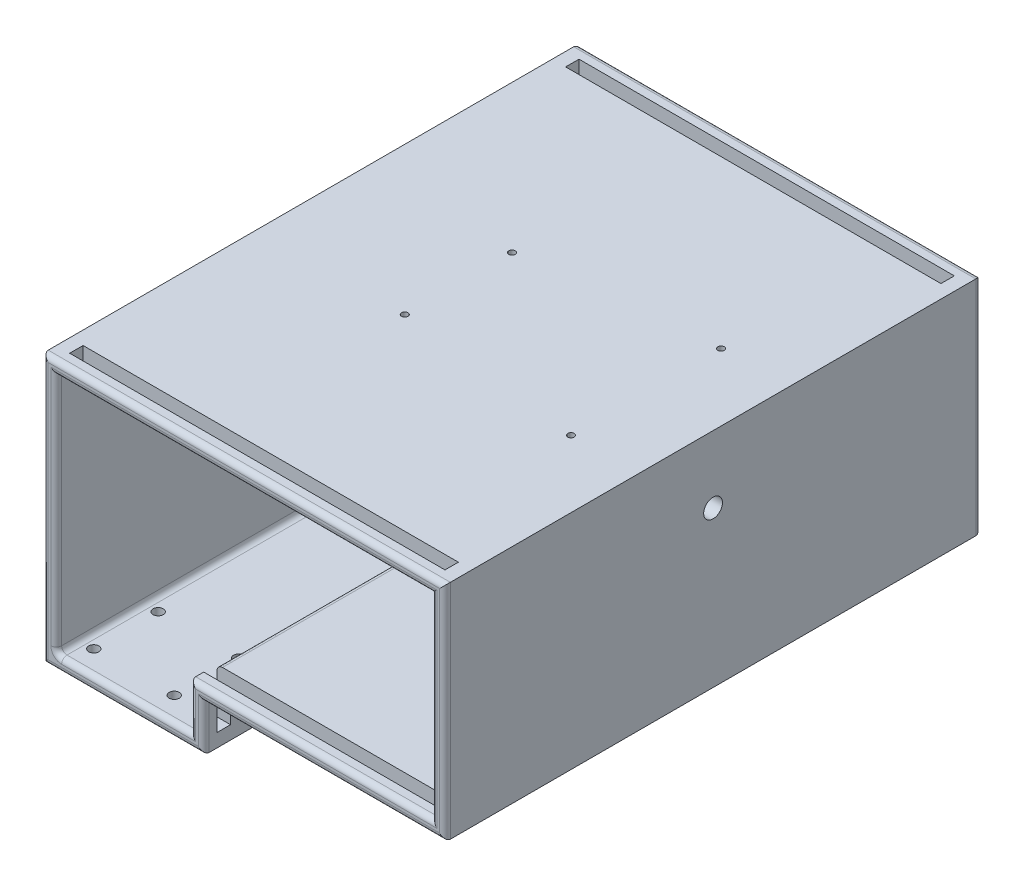
from build123d import *

# Parameters (mm, degrees)
SKETCH1_W           = 150
SKETCH1_H           = 200
BOSS_EXTRUDE1_DEPTH = 100
SHELL2_T            = -5
SKETCH5_R           = 1.9
CUT_EXTRUDE2_DEPTH  = 10
BOSS_EXTRUDE4_DEPTH = 200
SKETCH9_W           = 101.133931545
SKETCH9_H           = 31.996148617
CUT_EXTRUDE4_DEPTH  = 236.849528301
SKETCH10_R          = 4
CUT_EXTRUDE5_DEPTH  = 10
CUT_EXTRUDE7_REACH  = 162.078
SKETCH11_W          = 140
SKETCH11_H          = 5
SKETCH15_R          = 1.2
CUT_EXTRUDE11_DEPTH = 10
SKETCH36_W          = 60
SKETCH36_H          = 5
BOSS_EXTRUDE7_DEPTH = 10
FILLET1_R           = 2
SKETCH37_R          = 3.5
CUT_EXTRUDE15_DEPTH = 60
SKETCH38_R          = 5
CUT_EXTRUDE16_DEPTH = 70


with BuildPart() as part:
    # Sketch1 → Boss-Extrude1 (new body)
    with BuildSketch(Plane(origin=(0, 0, 0), x_dir=(1, 0, 0), z_dir=(0, 1, 0))):
        Rectangle(SKETCH1_W, SKETCH1_H)
    extrude(amount=BOSS_EXTRUDE1_DEPTH)

    # Shell2
    shell2_openings = [part.faces().sort_by_distance(p)[0] for p in [
        (0, 50, -100),
        (0, 50, 100),
    ]]
    offset(amount=SHELL2_T, openings=shell2_openings, kind=Kind.INTERSECTION)

    # Sketch5 → Cut-Extrude2 (cut)
    with BuildSketch(Plane.XZ):
        with Locations(Location((-65, 91, 0), (0, 0, 270))):
            Circle(SKETCH5_R)
        with Locations(Location((-35, 91, 0), (0, 0, 270))):
            Circle(SKETCH5_R)
        with Locations(Location((-65, 67, 0), (0, 0, 270))):
            Circle(SKETCH5_R)
        with Locations(Location((-35, 67, 0), (0, 0, 270))):
            Circle(SKETCH5_R)
    cut_extrude2 = extrude(amount=-CUT_EXTRUDE2_DEPTH, mode=Mode.SUBTRACT)

    # Mirror2: Cut-Extrude2 across plane
    add(cut_extrude2.mirror(Plane.XY), mode=Mode.SUBTRACT)

    # Sketch8 → Boss-Extrude4 (add, through all)
    with BuildSketch(Plane.XY.offset(100)):
        Polygon((-15, 17), (75, 17), (75, 22), (-20, 22), (-20, 0), (-15, 0), align=None)
    extrude(amount=-BOSS_EXTRUDE4_DEPTH)

    # Sketch9 → Cut-Extrude4 (cut, through all)
    with BuildSketch(Plane.XY.offset(100)):
        with Locations((35.566965773, 1.001925691)):
            Rectangle(SKETCH9_W, SKETCH9_H)
    extrude(amount=-CUT_EXTRUDE4_DEPTH, mode=Mode.SUBTRACT)

    # Sketch10 → Cut-Extrude5 (cut)
    with BuildSketch(Plane.XZ.offset(-17)):
        with Locations((60, 0)):
            Circle(SKETCH10_R)
    extrude(amount=-CUT_EXTRUDE5_DEPTH, mode=Mode.SUBTRACT)

    # Cut-Extrude7: up to this face of the body (flat: up to its plane)
    cut_extrude7_end = Plane(part.part.faces().sort_by_distance((-44.954220044, 5, 0))[0])
    # Sketch11 → Cut-Extrude7 (cut, up to the picked face)
    with BuildSketch(Plane(origin=(0, 100, 0), x_dir=(1, 0, 0), z_dir=(0, 1, 0)), mode=Mode.PRIVATE) as cut_extrude7_sk1:
        with Locations((0, -92.5)):
            Rectangle(SKETCH11_W, SKETCH11_H)
    cut_extrude7_tool1 = split(extrude(cut_extrude7_sk1.sketch, amount=-CUT_EXTRUDE7_REACH, mode=Mode.PRIVATE), bisect_by=cut_extrude7_end, keep=Keep.BOTH, mode=Mode.PRIVATE)
    cut_extrude7 = cut_extrude7_tool1.solids().sort_by(Axis((0, 100, 92.5), (0, -1, 0)))[0]
    add(cut_extrude7, mode=Mode.SUBTRACT)

    # Mirror3: Cut-Extrude7 across plane
    add(cut_extrude7.mirror(Plane.XY), mode=Mode.SUBTRACT)

    # Sketch15 → Cut-Extrude11 (cut)
    with BuildSketch(Plane(origin=(0, 100, 0), x_dir=(1, 0, 0), z_dir=(0, 1, 0))):
        with Locations(Location((50, 28, 0), (0, 0, 270))):
            Circle(SKETCH15_R)
        with Locations(Location((50, -28, 0), (0, 0, 270))):
            Circle(SKETCH15_R)
        with Locations(Location((-20, 20, 0), (0, 0, 270))):
            Circle(SKETCH15_R)
        with Locations(Location((-20, -20, 0), (0, 0, 270))):
            Circle(SKETCH15_R)
    extrude(amount=-CUT_EXTRUDE11_DEPTH, mode=Mode.SUBTRACT)

    # Sketch36 → Boss-Extrude7 (add)
    with BuildSketch(Plane.ZY.offset(-70)):
        with Locations((-13.202053215, 62.5)):
            Rectangle(SKETCH36_W, SKETCH36_H)
    boss_extrude7 = extrude(amount=BOSS_EXTRUDE7_DEPTH)

    # Mirror5: Boss-Extrude7 across plane
    add(boss_extrude7.mirror(Plane(origin=(0, 0, 0), x_dir=(0, 0, 1), z_dir=(1, 0, 0))))

    # Fillet1
    fillet1_edges = [part.edges().sort_by_distance(p)[0] for p in [
        (-45, 0, -100),
        (-20, 5, 0),
        (70, 22, 0),
        (70, 95, 0),
        (0, 100, 100),
        (70, 58.5, 100),
        (70, 58.5, -100),
        (-70, 5, 0),
        (-70, 50, -100),
        (-45, 5, 100),
        (-70, 50, 100),
        (0, 95, -100),
        (0, 95, 100),
        (-20, 22, 0),
        (-70, 95, 0),
        (-15, 17, 0),
        (70, 60, -13.202053215),
        (70, 65, -13.202053215),
        (-70, 60, -13.202053215),
        (-70, 65, -13.202053215),
        (-45, 0, 100),
        (-45, 5, -100),
        (75, 58.5, 100),
        (-75, 50, 100),
        (-75, 50, -100),
        (75, 58.5, -100),
        (-15, 8.5, 100),
        (25, 22, 100),
        (-20, 13.5, -100),
        (30, 17, -100),
        (25, 22, -100),
        (-20, 13.5, 100),
        (-15, 8.5, -100),
        (30, 17, 100),
        (0, 100, -100),
    ]]
    fillet(fillet1_edges, radius=FILLET1_R)

    # Sketch37 → Cut-Extrude15 (cut)
    with BuildSketch(Plane(origin=(75, 0, 0), x_dir=(0, 0, -1), z_dir=(1, 0, 0))):
        with Locations((0, 75)):
            Circle(SKETCH37_R)
    extrude(amount=-CUT_EXTRUDE15_DEPTH, mode=Mode.SUBTRACT)

    # Sketch38 → Cut-Extrude16 (cut)
    with BuildSketch(Plane.ZY.offset(75)):
        with Locations((0, 80)):
            Circle(SKETCH38_R)
    extrude(amount=-CUT_EXTRUDE16_DEPTH, mode=Mode.SUBTRACT)


solid = part.part
